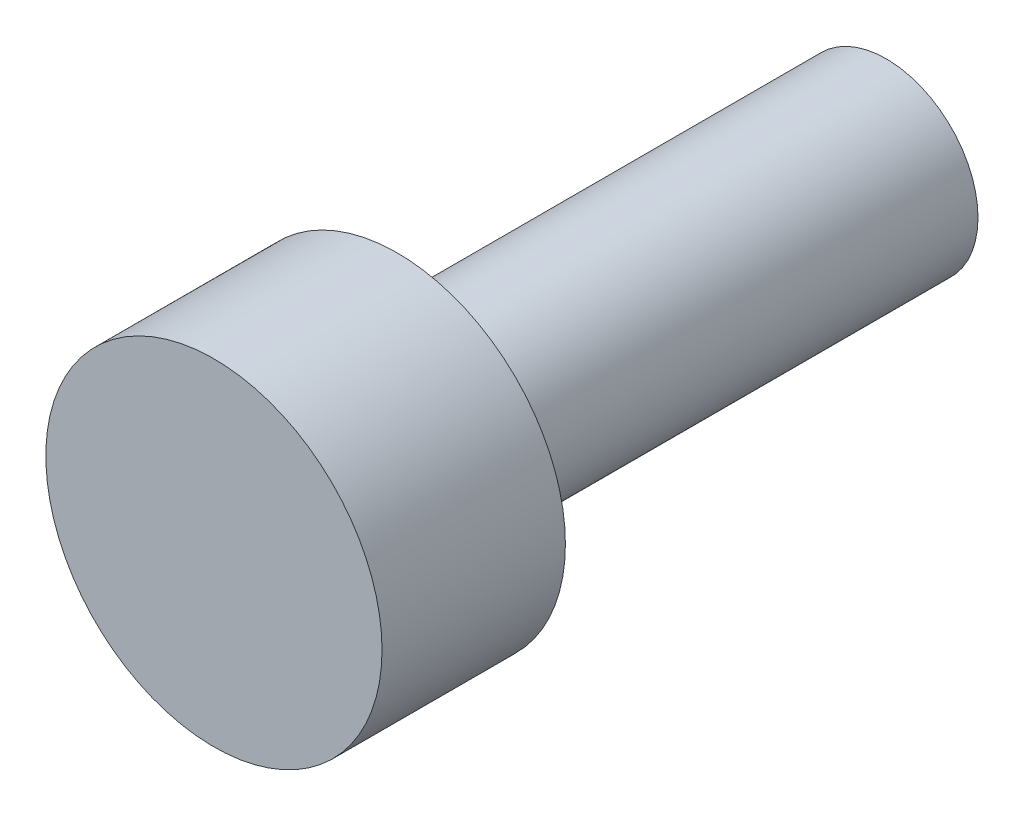
from build123d import *

# Parameters (mm, degrees)
SKETCH_1_R        = 1.5
EXTRUDE_M3_DEPTH  = 8
EXTRUDE_START     = 8
SKETCH_2_R        = 2.75
EXTRUDE_265_DEPTH = 3


with BuildPart() as part:
    # 草图1 → M3杆 (new body)
    with BuildSketch(Plane.XY):
        Circle(SKETCH_1_R)
    extrude(amount=EXTRUDE_M3_DEPTH)

    # 草图2 → Extrude 265 (add)
    with BuildSketch(Plane.XY.offset(EXTRUDE_START)):
        Circle(SKETCH_2_R)
    extrude(amount=EXTRUDE_265_DEPTH)


solid = part.part
